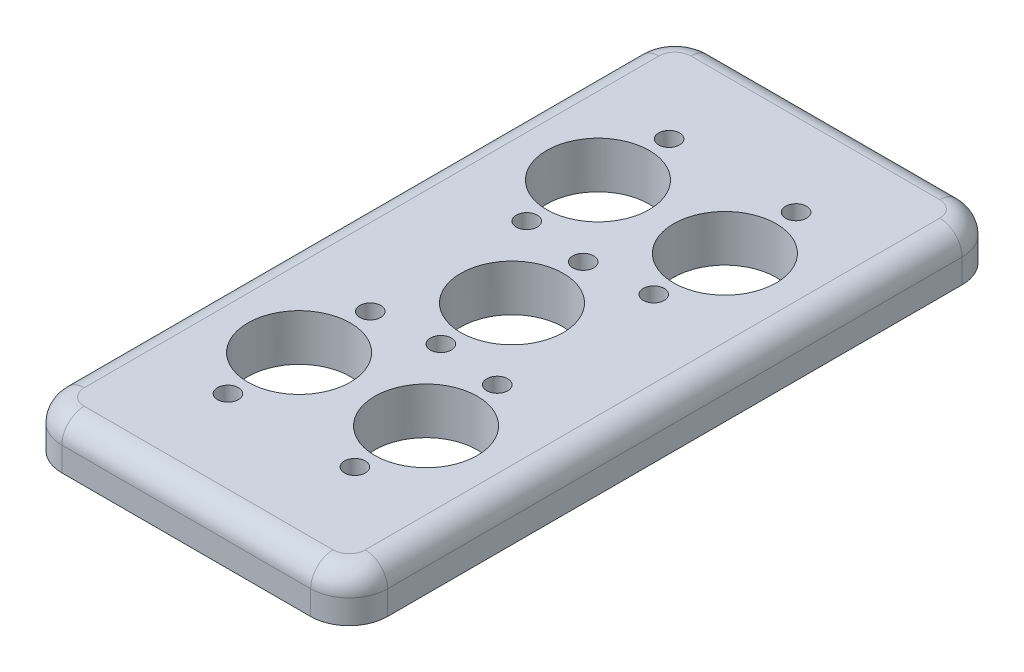
from build123d import *

# Parameters (mm, degrees)
SKETCH1_W             = 50.8
SKETCH1_H             = 101.6
BOSS_EXTRUDE1_DEPTH   = 7.25
FILLET1_R             = 6
FILLET2_R             = 3.5
CUT_EXTRUDE1_REACH    = 59.257
SKETCH2_R             = 8
F_4_CLEARANCE_HOLE1_D = 3.2639


with BuildPart() as part:
    # Sketch1 → Boss-Extrude1 (new body)
    with BuildSketch(Plane(origin=(0, 0, 0), x_dir=(1, 0, 0), z_dir=(0, 1, 0))):
        Rectangle(SKETCH1_W, SKETCH1_H)
    extrude(amount=BOSS_EXTRUDE1_DEPTH)

    # Fillet1
    fillet1_edges = [part.edges().sort_by_distance(p)[0] for p in [
        (25.4, 3.625, 50.8),
        (-25.4, 3.625, 50.8),
        (-25.4, 3.625, -50.8),
        (25.4, 3.625, -50.8),
    ]]
    fillet(fillet1_edges, radius=FILLET1_R)

    # Fillet2
    fillet2_edges = [part.edges().sort_by_distance(p)[0] for p in [
        (0, 7.25, -50.8),
        (25.4, 7.25, 0),
        (-25.4, 7.25, 0),
        (0, 7.25, 50.8),
        (23.642640687, 7.25, 49.042640687),
        (-23.642640687, 7.25, 49.042640687),
        (-23.642640687, 7.25, -49.042640687),
        (23.642640687, 7.25, -49.042640687),
    ]]
    fillet(fillet2_edges, radius=FILLET2_R)

    # Sketch2 → Cut-Extrude1 (cut, up to next)
    with BuildSketch(Plane.XZ, mode=Mode.PRIVATE) as cut_extrude1_sk1:
        with Locations(Location((0, 0, 0), (0, 0, 270))):
            Circle(SKETCH2_R)
    cut_extrude1_tool1 = extrude(cut_extrude1_sk1.sketch, amount=-CUT_EXTRUDE1_REACH, mode=Mode.PRIVATE) & part.part
    # Sketch2 → Cut-Extrude1 (cut, up to next)
    with BuildSketch(Plane.XZ, mode=Mode.PRIVATE) as cut_extrude1_sk2:
        with Locations(Location((9.9, 23.3, 0), (0, 0, 270))):
            Circle(SKETCH2_R)
    cut_extrude1_tool2 = extrude(cut_extrude1_sk2.sketch, amount=-CUT_EXTRUDE1_REACH, mode=Mode.PRIVATE) & part.part
    # Sketch2 → Cut-Extrude1 (cut, up to next)
    with BuildSketch(Plane.XZ, mode=Mode.PRIVATE) as cut_extrude1_sk3:
        with Locations(Location((-9.9, 23.3, 0), (0, 0, 270))):
            Circle(SKETCH2_R)
    cut_extrude1_tool3 = extrude(cut_extrude1_sk3.sketch, amount=-CUT_EXTRUDE1_REACH, mode=Mode.PRIVATE) & part.part
    # Sketch2 → Cut-Extrude1 (cut, up to next)
    with BuildSketch(Plane.XZ, mode=Mode.PRIVATE) as cut_extrude1_sk4:
        with Locations(Location((9.9, -23.3, 0), (0, 0, 270))):
            Circle(SKETCH2_R)
    cut_extrude1_tool4 = extrude(cut_extrude1_sk4.sketch, amount=-CUT_EXTRUDE1_REACH, mode=Mode.PRIVATE) & part.part
    # Sketch2 → Cut-Extrude1 (cut, up to next)
    with BuildSketch(Plane.XZ, mode=Mode.PRIVATE) as cut_extrude1_sk5:
        with Locations(Location((-9.9, -23.3, 0), (0, 0, 270))):
            Circle(SKETCH2_R)
    cut_extrude1_tool5 = extrude(cut_extrude1_sk5.sketch, amount=-CUT_EXTRUDE1_REACH, mode=Mode.PRIVATE) & part.part
    add(cut_extrude1_tool1.solids().sort_by_distance((0, 0, 0))[0], mode=Mode.SUBTRACT)
    add(cut_extrude1_tool2.solids().sort_by_distance((9.9, 0, 23.3))[0], mode=Mode.SUBTRACT)
    add(cut_extrude1_tool3.solids().sort_by_distance((-9.9, 0, 23.3))[0], mode=Mode.SUBTRACT)
    add(cut_extrude1_tool4.solids().sort_by_distance((9.9, 0, -23.3))[0], mode=Mode.SUBTRACT)
    add(cut_extrude1_tool5.solids().sort_by_distance((-9.9, 0, -23.3))[0], mode=Mode.SUBTRACT)

    # #4 Clearance Hole1 (through all)
    with Locations(Plane(origin=(0, 7.25, 0), x_dir=(-1, 0, 0), z_dir=(0, 1, 0))):
        with Locations((-9.9, 12.2), (-9.9, 34.4), (9.9, 34.4), (9.9, 12.2), (0, 11.1), (0, -11.1), (9.9, -12.2), (-9.9, -12.2), (9.9, -34.4), (-9.9, -34.4)):
            Hole(F_4_CLEARANCE_HOLE1_D / 2)


solid = part.part
